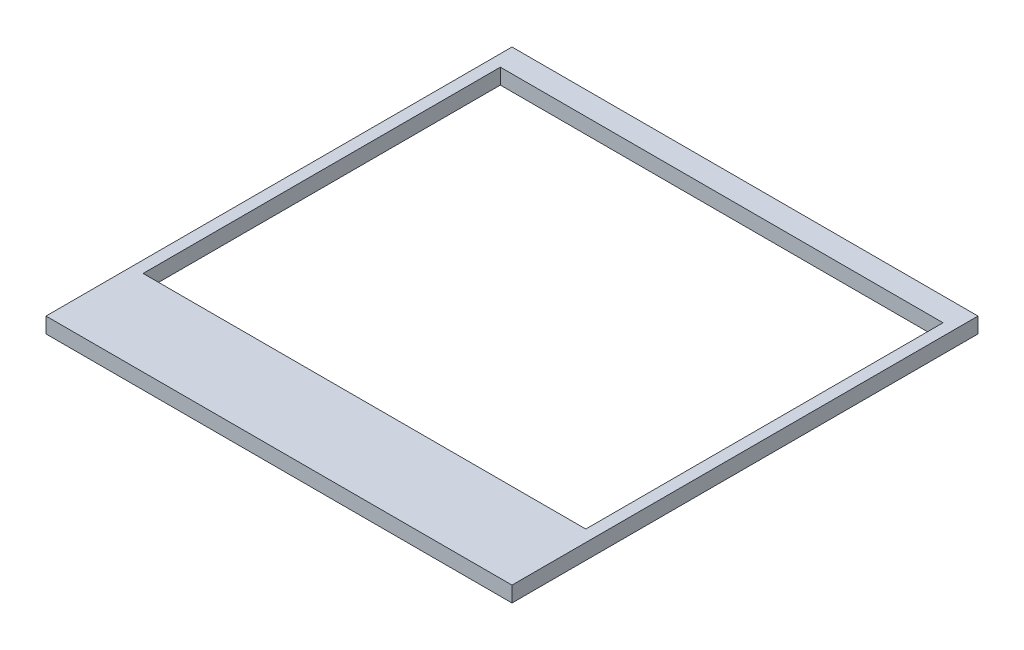
from build123d import *

# Parameters (mm, degrees)
SKETCH1_W               = 76.2
SKETCH1_H               = 76.2
BODY_DEPTH              = 2.54
SKETCH2_W               = 72.39
SKETCH2_H               = 58.42
CIRCUITBOARD_HOLE_DEPTH = 2.54


with BuildPart() as part:
    # Sketch1 → body (new body)
    with BuildSketch(Plane(origin=(0, 0, 0), x_dir=(1, 0, 0), z_dir=(0, 1, 0))):
        Rectangle(SKETCH1_W, SKETCH1_H)
    extrude(amount=BODY_DEPTH)

    # Sketch2 → circuitboard hole (cut)
    with BuildSketch(Plane(origin=(0, 2.54, 0), x_dir=(1, 0, 0), z_dir=(0, 1, 0))):
        with Locations((0, 5.08)):
            Rectangle(SKETCH2_W, SKETCH2_H)
    extrude(amount=-CIRCUITBOARD_HOLE_DEPTH, mode=Mode.SUBTRACT)


solid = part.part
